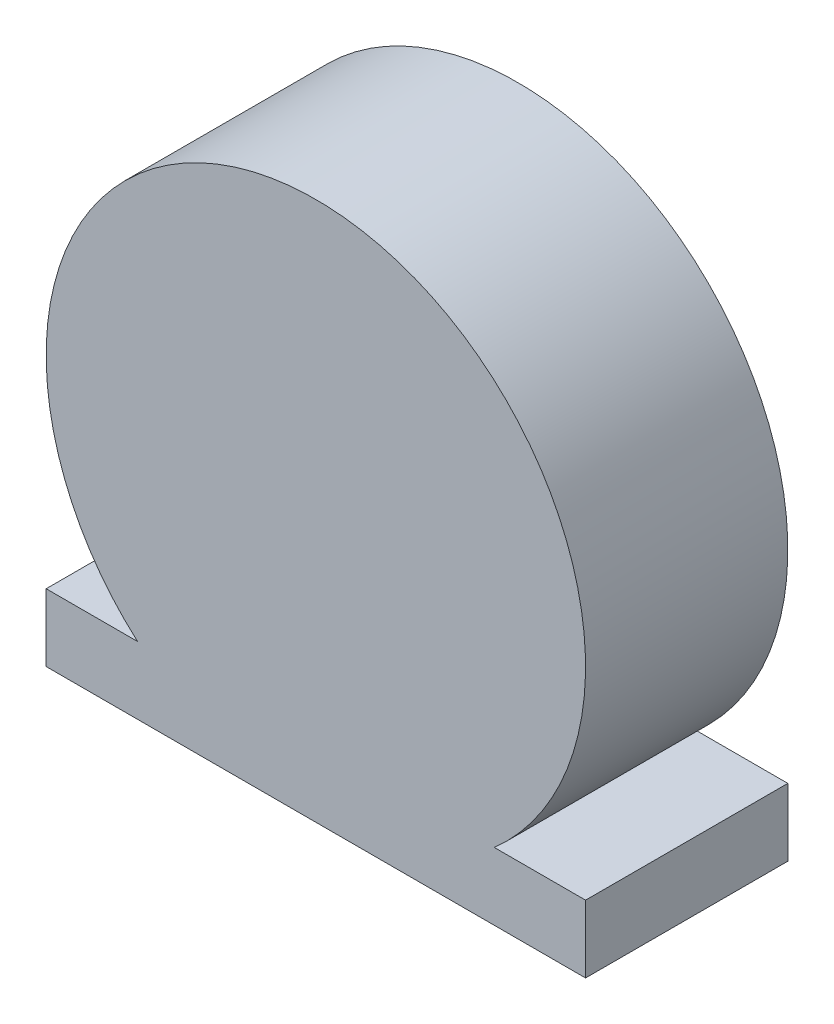
from build123d import *

# Parameters (mm, degrees)
SKETCH1_R           = 20
BOSS_EXTRUDE1_DEPTH = 15
SKETCH2_W           = 40
SKETCH2_H           = 5
BOSS_EXTRUDE2_DEPTH = 15
SKETCH3_R           = 15.875
CUT_EXTRUDE1_DEPTH  = 10


with BuildPart() as part:
    # Sketch1 → Boss-Extrude1 (new body)
    with BuildSketch(Plane.XY):
        Circle(SKETCH1_R)
    extrude(amount=BOSS_EXTRUDE1_DEPTH)

    # Sketch2 → Boss-Extrude2 (add)
    with BuildSketch(Plane(origin=(0, 0, 0), x_dir=(-1, 0, 0), z_dir=(0, 0, -1))):
        with Locations((0, -17.5)):
            Rectangle(SKETCH2_W, SKETCH2_H)
    extrude(amount=-BOSS_EXTRUDE2_DEPTH)

    # Sketch3 → Cut-Extrude1 (cut)
    with BuildSketch(Plane(origin=(0, 0, 0), x_dir=(-1, 0, 0), z_dir=(0, 0, -1))):
        Circle(SKETCH3_R)
    extrude(amount=-CUT_EXTRUDE1_DEPTH, mode=Mode.SUBTRACT)


solid = part.part
